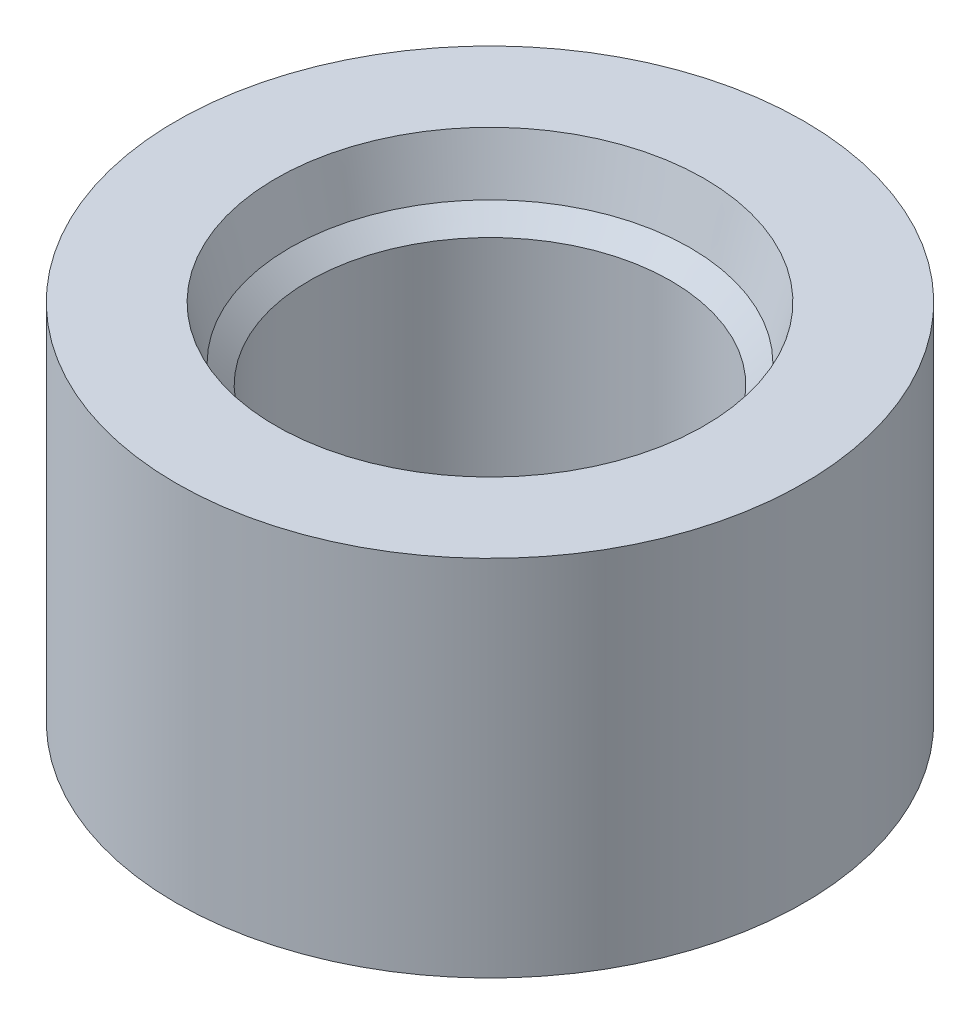
from build123d import *


with BuildPart() as part:
    # Sketch1 → Revolve1 (revolve)
    with BuildSketch(Plane.XY, mode=Mode.PRIVATE) as revolve1_sk:
        Polygon((8.6995, 0), (8.6995, 14.015590949), (9.619109051, 14.9352), (10.2997, 17.4752), (15.0876, 17.4752), (15.0876, 0), align=None)
    revolve(revolve1_sk.sketch.rotate(Axis((0, 0, 0), (0, 1, 0)), 90), axis=Axis((0, 0, 0), (0, 1, 0)))


solid = part.part
